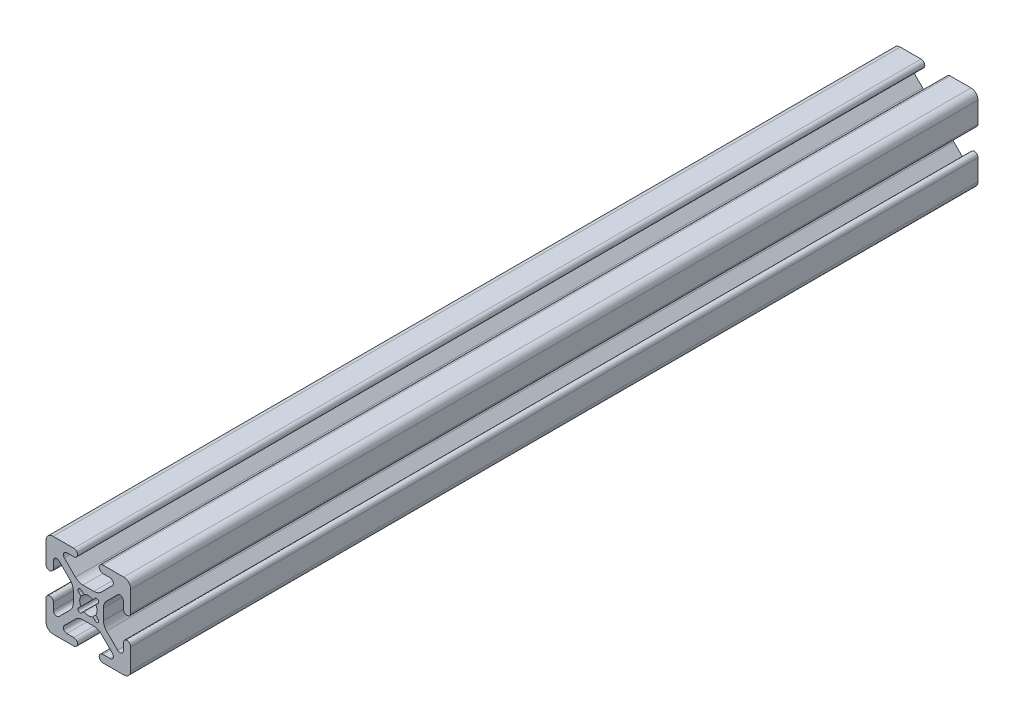
from build123d import *

# Parameters (mm, degrees)
EXTRUDE1_DEPTH = 254


with BuildPart() as part:
    # Sketch1 → Extrude1 (new body)
    with BuildSketch(Plane.XY):
        with BuildLine():
            Line((-3.88464389, 5.447103113), (-7.193320288, 8.75577951))
            ThreePointArc((-7.193320288, 8.75577951), (-7.413561403, 9.863006367), (-6.474899798, 10.4902))
            Line((-6.474899798, 10.4902), (-4.3561, 10.4902))
            ThreePointArc((-4.3561, 10.4902), (-3.2512, 11.5951), (-4.3561, 12.7))
            Line((-4.3561, 12.7), (-10.5918, 12.7))
            ThreePointArc((-10.5918, 12.7), (-12.082522516, 12.082522516), (-12.7, 10.5918))
            Line((-12.7, 10.5918), (-12.7, 4.3561))
            ThreePointArc((-12.7, 4.3561), (-11.5951, 3.2512), (-10.4902, 4.3561))
            Line((-10.4902, 4.3561), (-10.4902, 6.474899798))
            ThreePointArc((-10.4902, 6.474899798), (-9.863006367, 7.413561403), (-8.75577951, 7.193320288))
            Line((-8.75577951, 7.193320288), (-5.447103113, 3.88464389))
            ThreePointArc((-5.447103113, 3.88464389), (-4.758849627, 2.854599758), (-4.517167143, 1.63957986))
            Line((-4.517167143, 1.63957986), (-4.517167143, -1.63957986))
            ThreePointArc((-4.517167143, -1.63957986), (-4.758849627, -2.854599758), (-5.447103113, -3.88464389))
            Line((-5.447103113, -3.88464389), (-8.75577951, -7.193320288))
            ThreePointArc((-8.75577951, -7.193320288), (-9.863006367, -7.413561403), (-10.4902, -6.474899798))
            Line((-10.4902, -6.474899798), (-10.4902, -4.3561))
            ThreePointArc((-10.4902, -4.3561), (-11.5951, -3.2512), (-12.7, -4.3561))
            Line((-12.7, -4.3561), (-12.7, -10.5918))
            ThreePointArc((-12.7, -10.5918), (-12.082522516, -12.082522516), (-10.5918, -12.7))
            Line((-10.5918, -12.7), (-4.3561, -12.7))
            ThreePointArc((-4.3561, -12.7), (-3.2512, -11.5951), (-4.3561, -10.4902))
            Line((-4.3561, -10.4902), (-6.474899798, -10.4902))
            ThreePointArc((-6.474899798, -10.4902), (-7.413561403, -9.863006367), (-7.193320288, -8.75577951))
            Line((-7.193320288, -8.75577951), (-3.88464389, -5.447103113))
            ThreePointArc((-3.88464389, -5.447103113), (-2.854599758, -4.758849627), (-1.63957986, -4.517167143))
            Line((-1.63957986, -4.517167143), (1.63957986, -4.517167143))
            ThreePointArc((1.63957986, -4.517167143), (2.854599758, -4.758849627), (3.88464389, -5.447103113))
            Line((3.88464389, -5.447103113), (7.193320288, -8.75577951))
            ThreePointArc((7.193320288, -8.75577951), (7.413561403, -9.863006367), (6.474899798, -10.4902))
            Line((6.474899798, -10.4902), (4.3561, -10.4902))
            ThreePointArc((4.3561, -10.4902), (3.2512, -11.5951), (4.3561, -12.7))
            Line((4.3561, -12.7), (10.5918, -12.7))
            ThreePointArc((10.5918, -12.7), (12.082522516, -12.082522516), (12.7, -10.5918))
            Line((12.7, -10.5918), (12.7, -4.3561))
            ThreePointArc((12.7, -4.3561), (11.5951, -3.2512), (10.4902, -4.3561))
            Line((10.4902, -4.3561), (10.4902, -6.474899798))
            ThreePointArc((10.4902, -6.474899798), (9.863006367, -7.413561403), (8.75577951, -7.193320288))
            Line((8.75577951, -7.193320288), (5.447103113, -3.88464389))
            ThreePointArc((5.447103113, -3.88464389), (4.758849627, -2.854599758), (4.517167143, -1.63957986))
            Line((4.517167143, -1.63957986), (4.517167143, 1.63957986))
            ThreePointArc((4.517167143, 1.63957986), (4.758849627, 2.854599758), (5.447103113, 3.88464389))
            Line((5.447103113, 3.88464389), (8.75577951, 7.193320288))
            ThreePointArc((8.75577951, 7.193320288), (9.863006367, 7.413561403), (10.4902, 6.474899798))
            Line((10.4902, 6.474899798), (10.4902, 4.3561))
            ThreePointArc((10.4902, 4.3561), (11.5951, 3.2512), (12.7, 4.3561))
            Line((12.7, 4.3561), (12.7, 10.5918))
            ThreePointArc((12.7, 10.5918), (12.082522516, 12.082522516), (10.5918, 12.7))
            Line((10.5918, 12.7), (4.3561, 12.7))
            ThreePointArc((4.3561, 12.7), (3.2512, 11.5951), (4.3561, 10.4902))
            Line((4.3561, 10.4902), (6.474899798, 10.4902))
            ThreePointArc((6.474899798, 10.4902), (7.413561403, 9.863006367), (7.193320288, 8.75577951))
            Line((7.193320288, 8.75577951), (3.88464389, 5.447103113))
            ThreePointArc((3.88464389, 5.447103113), (2.854599758, 4.758849627), (1.63957986, 4.517167143))
            Line((1.63957986, 4.517167143), (-1.63957986, 4.517167143))
            ThreePointArc((-1.63957986, 4.517167143), (-2.854599758, 4.758849627), (-3.88464389, 5.447103113))
        make_face()
        with BuildLine():
            Line((-2.860474191, -1.969151357), (-2.231856263, -1.340533428))
            ThreePointArc((-2.231856263, -1.340533428), (-2.6035, 0), (-2.231856263, 1.340533428))
            Line((-2.231856263, 1.340533428), (-2.860474191, 1.969151357))
            ThreePointArc((-2.860474191, 1.969151357), (-2.918583239, 2.918583239), (-1.969151357, 2.860474191))
            Line((-1.969151357, 2.860474191), (-1.340533428, 2.231856263))
            ThreePointArc((-1.340533428, 2.231856263), (0, 2.6035), (1.340533428, 2.231856263))
            Line((1.340533428, 2.231856263), (1.969151357, 2.860474191))
            ThreePointArc((1.969151357, 2.860474191), (2.918583239, 2.918583239), (2.860474191, 1.969151357))
            Line((2.860474191, 1.969151357), (2.231856263, 1.340533428))
            ThreePointArc((2.231856263, 1.340533428), (2.6035, 0), (2.231856263, -1.340533428))
            Line((2.231856263, -1.340533428), (2.860474191, -1.969151357))
            ThreePointArc((2.860474191, -1.969151357), (2.918583239, -2.918583239), (1.969151357, -2.860474191))
            Line((1.969151357, -2.860474191), (1.340533428, -2.231856263))
            ThreePointArc((1.340533428, -2.231856263), (0, -2.6035), (-1.340533428, -2.231856263))
            Line((-1.340533428, -2.231856263), (-1.969151357, -2.860474191))
            ThreePointArc((-1.969151357, -2.860474191), (-2.918583239, -2.918583239), (-2.860474191, -1.969151357))
        make_face(mode=Mode.SUBTRACT)
    extrude(amount=-EXTRUDE1_DEPTH)


solid = part.part
